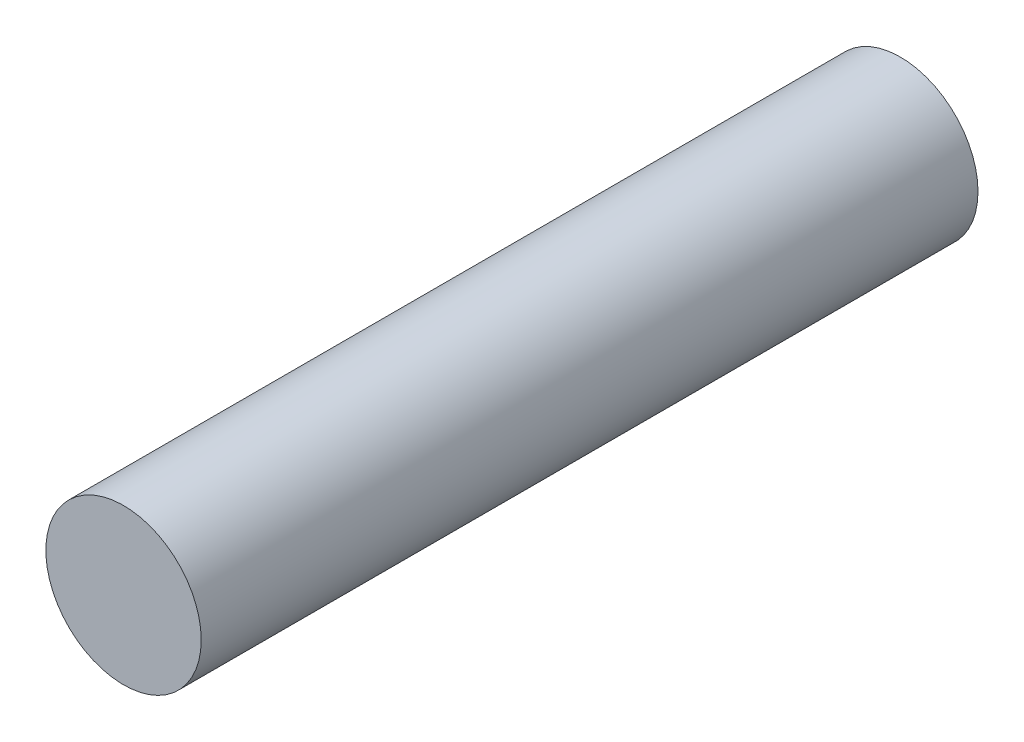
from build123d import *

# Parameters (mm, degrees)
SKETCH1_R           = 1
BOSS_EXTRUDE1_DEPTH = 10


with BuildPart() as part:
    # Sketch1 → Boss-Extrude1 (new body)
    with BuildSketch(Plane.XY):
        Circle(SKETCH1_R)
    extrude(amount=BOSS_EXTRUDE1_DEPTH)


solid = part.part
